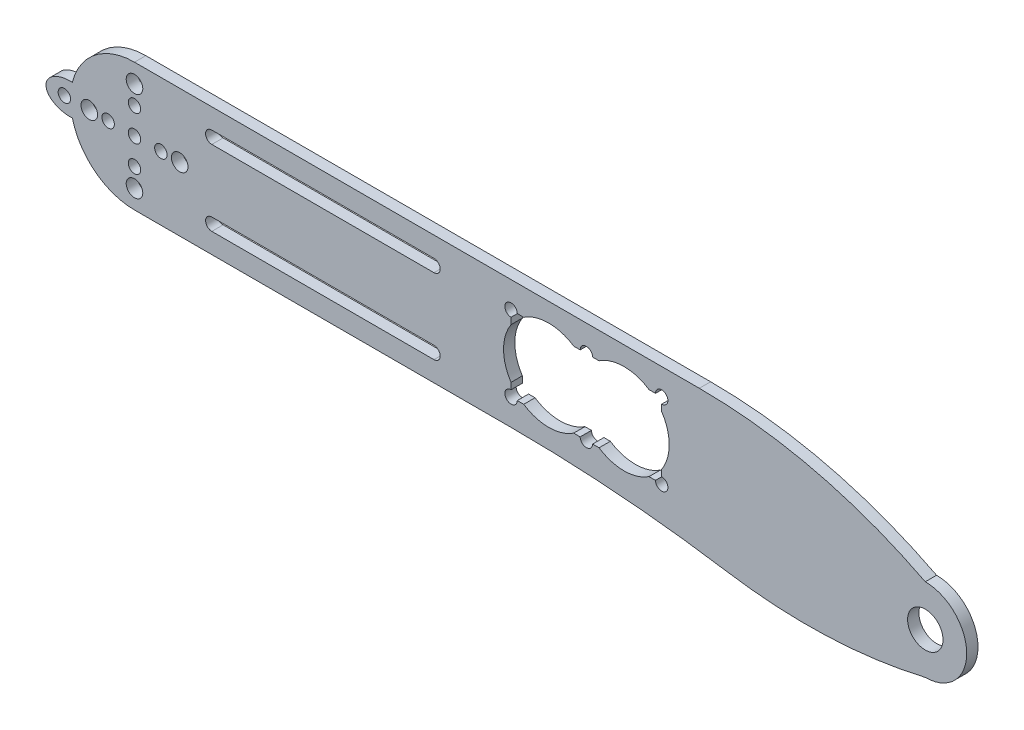
from build123d import *

# Parameters (mm, degrees)
SKETCH_1_R      = 1.65
SKETCH_1_R_2    = 2.2
SKETCH_1_R_3    = 4.7
EXTRUDE_2_DEPTH = 3
SKETCH_2_R      = 5.981334021
SKETCH_2_R_2    = 5
EXTRUDE_3_DEPTH = 3


with BuildPart() as part:
    # 草图1 → 凸台-拉伸2 (new body)
    with BuildSketch(Plane.XY):
        with BuildLine():
            ThreePointArc((-16.496458662, 12.893072729), (-10.468577659, 3.605639926), (0, 0))
            Line((0, 0), (100, 0))
            ThreePointArc((100, 0), (128.704894857, -1.12114561), (157.234899277, -4.47775163))
            ThreePointArc((157.234899277, -4.47775163), (183.713480844, -6.050924628), (210, -2.5))
            ThreePointArc((210, -2.5), (221, 8.5), (210, 19.5))
            ThreePointArc((210, 19.5), (180.86361126, 30.323563834), (150, 34))
            Line((150, 34), (0, 34))
            ThreePointArc((0, 34), (-10.468577659, 30.394360075), (-16.496458662, 21.106927271))
            add(Edge.make_bspline(
                [(-16.496458662, 21.106927271), (-23.502676935, 21.451644876), (-23.502676935, 17)],
                knots=[4.634875375, 4.634875375, 4.634875375, 6.283185307, 6.283185307, 6.283185307], degree=2, weights=[1, 0.679177441, 1]))
            add(Edge.make_bspline(
                [(-23.502676935, 17), (-23.502676935, 12.548355124), (-16.496458662, 12.893072729)],
                knots=[0, 0, 0, 1.648309932, 1.648309932, 1.648309932], degree=2, weights=[1, 0.679177441, 1]))
        make_face()
        with Locations((0, 17)):
            Circle(SKETCH_1_R, mode=Mode.SUBTRACT)
        with Locations((0, 10)):
            Circle(SKETCH_1_R, mode=Mode.SUBTRACT)
        with Locations((0, 5)):
            Circle(SKETCH_1_R_2, mode=Mode.SUBTRACT)
        with Locations((0, 29)):
            Circle(SKETCH_1_R_2, mode=Mode.SUBTRACT)
        with Locations((0, 24)):
            Circle(SKETCH_1_R, mode=Mode.SUBTRACT)
        with Locations((-7, 17)):
            Circle(SKETCH_1_R, mode=Mode.SUBTRACT)
        with Locations((-18.625669234, 17)):
            Circle(SKETCH_1_R, mode=Mode.SUBTRACT)
        with Locations((210, 8.5)):
            Circle(SKETCH_1_R_3, mode=Mode.SUBTRACT)
        with BuildLine():
            Line((140, 10.366750419), (140, 8.65))
            ThreePointArc((140, 8.65), (141.166726189, 5.833273811), (138.35, 7))
            Line((138.35, 7), (136.633249581, 7))
            ThreePointArc((136.633249581, 7), (130, 5), (123.366750419, 7))
            Line((123.366750419, 7), (121.65, 7))
            ThreePointArc((121.65, 7), (120, 5.35), (118.35, 7))
            Line((118.35, 7), (116.633249581, 7))
            ThreePointArc((116.633249581, 7), (110, 5), (103.366750419, 7))
            Line((103.366750419, 7), (101.65, 7))
            ThreePointArc((101.65, 7), (98.833273811, 5.833273811), (100, 8.65))
            Line((100, 8.65), (100, 10.366750419))
            ThreePointArc((100, 10.366750419), (98, 17), (100, 23.633249581))
            Line((100, 23.633249581), (100, 25.35))
            ThreePointArc((100, 25.35), (98.833273811, 28.166726189), (101.65, 27))
            Line((101.65, 27), (103.366750419, 27))
            ThreePointArc((103.366750419, 27), (110, 29), (116.633249581, 27))
            Line((116.633249581, 27), (118.35, 27))
            ThreePointArc((118.35, 27), (120, 28.65), (121.65, 27))
            Line((121.65, 27), (123.366750419, 27))
            ThreePointArc((123.366750419, 27), (130, 29), (136.633249581, 27))
            Line((136.633249581, 27), (138.35, 27))
            ThreePointArc((138.35, 27), (141.166726189, 28.166726189), (140, 25.35))
            Line((140, 25.35), (140, 23.633249581))
            ThreePointArc((140, 23.633249581), (142, 17), (140, 10.366750419))
        make_face(mode=Mode.SUBTRACT)
        with Locations((-12, 17)):
            Circle(SKETCH_1_R_2, mode=Mode.SUBTRACT)
        with Locations((7, 17)):
            Circle(SKETCH_1_R, mode=Mode.SUBTRACT)
        with Locations((12, 17)):
            Circle(SKETCH_1_R_2, mode=Mode.SUBTRACT)
        with BuildLine():
            Line((20.531708218, 28.65), (79.525747225, 28.65))
            ThreePointArc((79.525747225, 28.65), (81.175747225, 27), (79.525747225, 25.35))
            Line((79.525747225, 25.35), (20.531708218, 25.35))
            ThreePointArc((20.531708218, 25.35), (18.881708218, 27), (20.531708218, 28.65))
        make_face(mode=Mode.SUBTRACT)
        with BuildLine():
            Line((79.525747225, 5.35), (20.531708218, 5.35))
            ThreePointArc((20.531708218, 5.35), (18.881708218, 7), (20.531708218, 8.65))
            Line((20.531708218, 8.65), (79.525747225, 8.65))
            ThreePointArc((79.525747225, 8.65), (81.175747225, 7), (79.525747225, 5.35))
        make_face(mode=Mode.SUBTRACT)
    extrude(amount=EXTRUDE_2_DEPTH)

    # 草图2 → 凸台-拉伸3 (add)
    with BuildSketch(Plane.XY.offset(3)):
        with Locations((210, 8.5)):
            Circle(SKETCH_2_R)
        with Locations((210, 8.5)):
            Circle(SKETCH_2_R_2, mode=Mode.SUBTRACT)
    extrude(amount=-EXTRUDE_3_DEPTH)


solid = part.part
